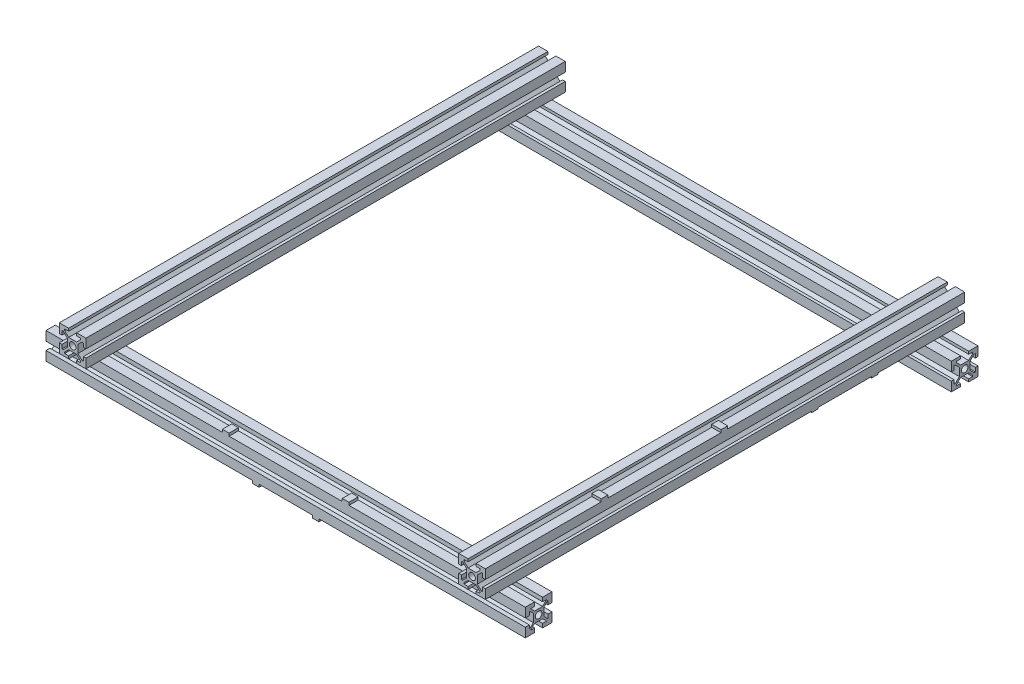
from build123d import *

# Parameters (mm, degrees)
SKETCH1_W            = 360
SKETCH1_H            = 360
BOSS_EXTRUDE1_DEPTH  = 20
SKETCH2_W            = 20
SKETCH2_H            = 320
SKETCH2_W_2          = 280
CUT_EXTRUDE1_DEPTH   = 256.342906696
SKETCH3_W            = 360
SKETCH3_H            = 20
BOSS_EXTRUDE2_DEPTH  = 20
SKETCH4_W            = 20
SKETCH4_H            = 20
CUT_EXTRUDE2_DEPTH   = 20
SKETCH5_W            = 280
SKETCH5_H            = 20
CUT_EXTRUDE3_DEPTH   = 20
SKETCH6_W            = 360
SKETCH6_H            = 20
BOSS_EXTRUDE3_DEPTH  = 10
SKETCH7_W            = 360
SKETCH7_H            = 20
BOSS_EXTRUDE4_DEPTH  = 10
SKETCH8_W            = 360
SKETCH8_H            = 20
CUT_EXTRUDE4_DEPTH   = 10
SKETCH9_W            = 360
SKETCH9_H            = 20
CUT_EXTRUDE5_DEPTH   = 10
SKETCH10_R           = 2.5
CUT_EXTRUDE6_DEPTH   = 403.988833592
CUT_EXTRUDE7_DEPTH   = 403.988833592
SKETCH12_W           = 0.321776328
SKETCH12_H           = 6
SKETCH12_W_2         = 2
SKETCH12_W_3         = 6
SKETCH12_H_2         = 2
CUT_EXTRUDE9_DEPTH   = 403.988833592
SKETCH13_W           = 6
SKETCH13_H           = 2
SKETCH13_W_2         = 2
SKETCH13_H_2         = 6
SKETCH13_R           = 2.5
CUT_EXTRUDE11_DEPTH  = 403.988833592
SKETCH15_W           = 6
SKETCH15_H           = 3
SKETCH15_W_2         = 3
SKETCH15_H_2         = 6
SKETCH15_R           = 2.5
CUT_EXTRUDE12_DEPTH  = 403.988833592
SKETCH16_W           = 6
SKETCH16_H           = 4
SKETCH16_H_2         = 2
SKETCH16_W_2         = 4
SKETCH16_H_3         = 6
SKETCH16_W_3         = 2
SKETCH16_R           = 2.5
CUT_EXTRUDE13_DEPTH  = 403.988833592
SKETCH17_W           = 7
SKETCH17_H           = 5
BOSS_EXTRUDE6_DEPTH  = 1
SKETCH18_W           = 7
SKETCH18_H           = 5
BOSS_EXTRUDE7_DEPTH  = 1
SKETCH19_W           = 5
SKETCH19_H           = 7
BOSS_EXTRUDE10_DEPTH = 2
SKETCH20_W           = 5
SKETCH20_H           = 7
BOSS_EXTRUDE11_DEPTH = 2
SKETCH21_W           = 7
SKETCH21_H           = 5
BOSS_EXTRUDE12_DEPTH = 2


with BuildPart() as part:
    # Sketch1 → Boss-Extrude1 (new body)
    with BuildSketch(Plane(origin=(0, 0, 0), x_dir=(1, 0, 0), z_dir=(0, 1, 0))):
        Rectangle(SKETCH1_W, SKETCH1_H)
    extrude(amount=BOSS_EXTRUDE1_DEPTH)

    # Sketch2 → Cut-Extrude1 (cut, through all)
    with BuildSketch(Plane(origin=(0, 20, 0), x_dir=(1, 0, 0), z_dir=(0, 1, 0))):
        with Locations((-170, 0)):
            Rectangle(SKETCH2_W, SKETCH2_H)
        with Locations((170, 0)):
            Rectangle(SKETCH2_W, SKETCH2_H)
        Rectangle(SKETCH2_W_2, SKETCH2_H)
    extrude(amount=-CUT_EXTRUDE1_DEPTH, mode=Mode.SUBTRACT)

    # Sketch3 → Boss-Extrude2 (add)
    with BuildSketch(Plane.XZ):
        with Locations((0, 170)):
            Rectangle(SKETCH3_W, SKETCH3_H)
        with Locations((0, -170)):
            Rectangle(SKETCH3_W, SKETCH3_H)
    extrude(amount=BOSS_EXTRUDE2_DEPTH)

    # Sketch4 → Cut-Extrude2 (cut)
    with BuildSketch(Plane(origin=(0, 20, 0), x_dir=(1, 0, 0), z_dir=(0, 1, 0))):
        with Locations((170, -170)):
            Rectangle(SKETCH4_W, SKETCH4_H)
        with Locations((-170, -170)):
            Rectangle(SKETCH4_W, SKETCH4_H)
        with Locations((-170, 170)):
            Rectangle(SKETCH4_W, SKETCH4_H)
        with Locations((170, 170)):
            Rectangle(SKETCH4_W, SKETCH4_H)
    extrude(amount=-CUT_EXTRUDE2_DEPTH, mode=Mode.SUBTRACT)

    # Sketch5 → Cut-Extrude3 (cut)
    with BuildSketch(Plane(origin=(0, 20, 0), x_dir=(1, 0, 0), z_dir=(0, 1, 0))):
        with Locations((0, 170)):
            Rectangle(SKETCH5_W, SKETCH5_H)
        with Locations((0, -170)):
            Rectangle(SKETCH5_W, SKETCH5_H)
    extrude(amount=-CUT_EXTRUDE3_DEPTH, mode=Mode.SUBTRACT)

    # Sketch6 → Boss-Extrude3 (add)
    with BuildSketch(Plane.XY.offset(-160)):
        with Locations((0, -10)):
            Rectangle(SKETCH6_W, SKETCH6_H)
    extrude(amount=BOSS_EXTRUDE3_DEPTH)

    # Sketch7 → Boss-Extrude4 (add)
    with BuildSketch(Plane(origin=(0, 0, 160), x_dir=(-1, 0, 0), z_dir=(0, 0, -1))):
        with Locations((0, -10)):
            Rectangle(SKETCH7_W, SKETCH7_H)
    extrude(amount=BOSS_EXTRUDE4_DEPTH)

    # Sketch8 → Cut-Extrude4 (cut)
    with BuildSketch(Plane(origin=(0, 0, -180), x_dir=(-1, 0, 0), z_dir=(0, 0, -1))):
        with Locations((0, -10)):
            Rectangle(SKETCH8_W, SKETCH8_H)
    extrude(amount=-CUT_EXTRUDE4_DEPTH, mode=Mode.SUBTRACT)

    # Sketch9 → Cut-Extrude5 (cut)
    with BuildSketch(Plane.XY.offset(180)):
        with Locations((0, -10)):
            Rectangle(SKETCH9_W, SKETCH9_H)
    extrude(amount=-CUT_EXTRUDE5_DEPTH, mode=Mode.SUBTRACT)

    # Sketch10 → Cut-Extrude6 (cut, through all)
    with BuildSketch(Plane(origin=(0, 0, -180), x_dir=(-1, 0, 0), z_dir=(0, 0, -1))):
        with Locations((150, 10)):
            Circle(SKETCH10_R)
    extrude(amount=-CUT_EXTRUDE6_DEPTH, mode=Mode.SUBTRACT)

    # Sketch11 → Cut-Extrude7 (cut, through all)
    with BuildSketch(Plane.XY.offset(180)):
        Polygon((-154, 13), (-157, 16), (-158, 16), (-158, 4), (-157, 4), (-154.03451258, 7.017074401), (-154, 6.983143579), (-154, 7), align=None)
        Polygon((-156, 18), (-156, 17), (-153, 14), (-147, 14), (-144, 17), (-144, 18), align=None)
        Polygon((-142, 16), (-142.974074805, 16), (-146, 12.974074805), (-146, 7), (-142.999589396, 4), (-142, 4), align=None)
        Polygon((-153, 6), (-156, 2.948563706), (-156, 2), (-144, 2), (-144, 2.948563706), (-147, 6), align=None)
    extrude(amount=-CUT_EXTRUDE7_DEPTH, mode=Mode.SUBTRACT)

    # Sketch12 → Cut-Extrude9 (cut, through all)
    with BuildSketch(Plane.XY.offset(180)):
        with Locations((-160.164496901, 10)):
            Rectangle(SKETCH12_W, SKETCH12_H)
        with Locations((-159, 10)):
            Rectangle(SKETCH12_W_2, SKETCH12_H)
        with Locations((-141, 10)):
            Rectangle(SKETCH12_W_2, SKETCH12_H)
        with Locations((-150, 1)):
            Rectangle(SKETCH12_W_3, SKETCH12_H_2)
        with Locations((-150, 19)):
            Rectangle(SKETCH12_W_3, SKETCH12_H_2)
    extrude(amount=-CUT_EXTRUDE9_DEPTH, mode=Mode.SUBTRACT)

    # Sketch13 → Cut-Extrude11 (cut, through all)
    with BuildSketch(Plane.XY.offset(180)):
        Polygon((156, 17), (144, 17), (147, 14), (153, 14), align=None)
        Polygon((144, 18), (144, 17), (156, 17), (156, 18), (153, 18), (147, 18), align=None)
        with Locations((150, 19)):
            Rectangle(SKETCH13_W, SKETCH13_H)
        Polygon((146, 13), (143, 16), (143, 4), (146, 7), align=None)
        Polygon((143, 4), (143, 16), (142, 16), (142, 13), (142, 7), (142, 4), align=None)
        Polygon((147, 6), (144, 3), (156, 3), (153, 6), align=None)
        Polygon((156, 3), (144, 3), (144, 2), (147, 2), (153, 2), (156, 2), align=None)
        with Locations((141, 10)):
            Rectangle(SKETCH13_W_2, SKETCH13_H_2)
        with Locations((150, 1)):
            Rectangle(SKETCH13_W, SKETCH13_H)
        with Locations((159, 10)):
            Rectangle(SKETCH13_W_2, SKETCH13_H_2)
        Polygon((158, 16), (157, 16), (157, 4), (158, 4), (158, 7), (158, 13), align=None)
        Polygon((157, 4), (157, 16), (154, 13), (154, 7), align=None)
        with Locations((150, 10)):
            Circle(SKETCH13_R)
    extrude(amount=-CUT_EXTRUDE11_DEPTH, mode=Mode.SUBTRACT)

    # Sketch15 → Cut-Extrude12 (cut, through all)
    with BuildSketch(Plane.ZY.offset(180)):
        Polygon((166, -17), (163, -14), (157, -14), (154, -17), (157, -17), (163, -17), align=None)
        with Locations((160, -18.5)):
            Rectangle(SKETCH15_W, SKETCH15_H)
        with Locations((168.5, -10)):
            Rectangle(SKETCH15_W_2, SKETCH15_H_2)
        with Locations((151.5, -10)):
            Rectangle(SKETCH15_W_2, SKETCH15_H_2)
        Polygon((156, -13), (156, -7), (153, -4), (153, -7), (153, -13), (153, -16), align=None)
        Polygon((157, -6), (163, -6), (166, -3), (163, -3), (157, -3), (154, -3), align=None)
        with Locations((160, -1.5)):
            Rectangle(SKETCH15_W, SKETCH15_H)
        Polygon((167, -4), (164, -7), (164, -13), (167, -16), (167, -13), (167, -7), align=None)
        with Locations((160, -10)):
            Circle(SKETCH15_R)
    extrude(amount=-CUT_EXTRUDE12_DEPTH, mode=Mode.SUBTRACT)

    # Sketch16 → Cut-Extrude13 (cut, through all)
    with BuildSketch(Plane(origin=(180, 0, 0), x_dir=(0, 0, -1), z_dir=(1, 0, 0))):
        Polygon((163, -2), (163, -6), (166, -3), (166, -2), align=None)
        with Locations((160, -4)):
            Rectangle(SKETCH16_W, SKETCH16_H)
        Polygon((154, -3), (157, -6), (157, -2), (154, -2), align=None)
        with Locations((160, -1)):
            Rectangle(SKETCH16_W, SKETCH16_H_2)
        with Locations((166, -10)):
            Rectangle(SKETCH16_W_2, SKETCH16_H_3)
        Polygon((167, -4), (164, -7), (168, -7), (168, -4), align=None)
        with Locations((169, -10)):
            Rectangle(SKETCH16_W_3, SKETCH16_H_3)
        Polygon((168, -13), (164, -13), (167, -16), (168, -16), align=None)
        Polygon((166, -17), (163, -14), (163, -18), (166, -18), align=None)
        with Locations((160, -16)):
            Rectangle(SKETCH16_W, SKETCH16_H)
        Polygon((157, -18), (157, -14), (154, -17), (154, -18), align=None)
        with Locations((160, -19)):
            Rectangle(SKETCH16_W, SKETCH16_H_2)
        Polygon((153, -16), (156, -13), (152, -13), (152, -16), align=None)
        with Locations((154, -10)):
            Rectangle(SKETCH16_W_2, SKETCH16_H_3)
        Polygon((152, -7), (156, -7), (153, -4), (152, -4), align=None)
        with Locations((151, -10)):
            Rectangle(SKETCH16_W_3, SKETCH16_H_3)
        with Locations((160, -10)):
            Circle(SKETCH16_R)
    extrude(amount=-CUT_EXTRUDE13_DEPTH, mode=Mode.SUBTRACT)

    # Sketch17 → Boss-Extrude6 (add)
    with BuildSketch(Plane.XZ):
        with Locations((156.5, -112.5)):
            Rectangle(SKETCH17_W, SKETCH17_H)
        with Locations((156.5, -67.5)):
            Rectangle(SKETCH17_W, SKETCH17_H)
    extrude(amount=BOSS_EXTRUDE6_DEPTH)

    # Sketch18 → Boss-Extrude7 (add)
    with BuildSketch(Plane.XZ):
        with Locations((-156.5, -67.5)):
            Rectangle(SKETCH18_W, SKETCH18_H)
        with Locations((-156.5, -112.5)):
            Rectangle(SKETCH18_W, SKETCH18_H)
    extrude(amount=BOSS_EXTRUDE7_DEPTH)

    # Sketch19 → Boss-Extrude10 (add)
    with BuildSketch(Plane(origin=(0, 0, 0), x_dir=(1, 0, 0), z_dir=(0, 1, 0))):
        with Locations((-45, -166.5)):
            Rectangle(SKETCH19_W, SKETCH19_H)
        with Locations((45, -166.5)):
            Rectangle(SKETCH19_W, SKETCH19_H)
    extrude(amount=BOSS_EXTRUDE10_DEPTH)

    # Sketch20 → Boss-Extrude11 (add)
    with BuildSketch(Plane.XZ.offset(20)):
        with Locations((-22.5, 166.5)):
            Rectangle(SKETCH20_W, SKETCH20_H)
        with Locations((22.5, 166.5)):
            Rectangle(SKETCH20_W, SKETCH20_H)
    extrude(amount=BOSS_EXTRUDE11_DEPTH)

    # Sketch21 → Boss-Extrude12 (add)
    with BuildSketch(Plane(origin=(0, 20, 0), x_dir=(1, 0, 0), z_dir=(0, 1, 0))):
        with Locations((156.5, -0.526687621)):
            Rectangle(SKETCH21_W, SKETCH21_H)
        with Locations((156.5, -90.526687621)):
            Rectangle(SKETCH21_W, SKETCH21_H)
    extrude(amount=BOSS_EXTRUDE12_DEPTH)


solid = part.part
